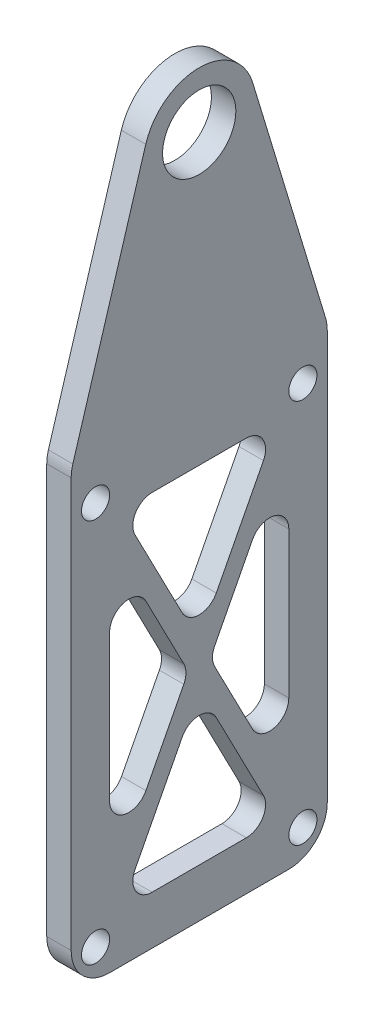
from build123d import *

# Parameters (mm, degrees)
SKETCH1_R           = 1.8288
SKETCH1_R_2         = 4.7625
BOSS_EXTRUDE1_DEPTH = 3.175
CUT_EXTRUDE1_DEPTH  = 57.415004653
FILLET1_R           = 2.5
FILLET2_R           = 5


with BuildPart() as part:
    # Sketch1 → Boss-Extrude1 (new body)
    with BuildSketch(Plane(origin=(0, 0, 0), x_dir=(0, 0, -1), z_dir=(1, 0, 0))):
        with BuildLine():
            Line((-16.645, -53.81), (16.645, -53.81))
            Line((16.645, -53.81), (16.645, 5.15))
            Line((16.645, 5.15), (6.94973031, 37.108353593))
            ThreePointArc((6.94973031, 37.108353593), (0, 42.2625), (-6.94973031, 37.108353593))
            Line((-6.94973031, 37.108353593), (-16.645, 5.15))
            Line((-16.645, 5.15), (-16.645, -53.81))
        make_face()
        with Locations((-13.4747, 0)):
            Circle(SKETCH1_R, mode=Mode.SUBTRACT)
        with Locations((0, 35)):
            Circle(SKETCH1_R_2, mode=Mode.SUBTRACT)
        with Locations((13.4747, 0)):
            Circle(SKETCH1_R, mode=Mode.SUBTRACT)
        with Locations((-13.4747, -50)):
            Circle(SKETCH1_R, mode=Mode.SUBTRACT)
        with Locations((13.4747, -50)):
            Circle(SKETCH1_R, mode=Mode.SUBTRACT)
    extrude(amount=BOSS_EXTRUDE1_DEPTH)

    # Sketch2 → Cut-Extrude1 (cut, through all)
    with BuildSketch(Plane(origin=(3.175, 0, 0), x_dir=(0, 0, -1), z_dir=(1, 0, 0))):
        Polygon((11.645, -5.219501679), (1.407493202, -25), (11.645, -44.780498321), align=None)
        Polygon((0, -27.719501679), (-10.237506798, -47.5), (10.237506798, -47.5), align=None)
        Polygon((-11.645, -5.219501679), (-11.645, -44.780498321), (-1.407493202, -25), align=None)
        Polygon((-10.237506798, -2.5), (0, -22.280498321), (10.237506798, -2.5), align=None)
    extrude(amount=-CUT_EXTRUDE1_DEPTH, mode=Mode.SUBTRACT)

    # Fillet1
    fillet1_edges = [part.edges().sort_by_distance(p)[0] for p in [
        (1.5875, -44.780498321, 11.645),
        (1.5875, -5.219501679, 11.645),
        (1.5875, -25, 1.407493202),
        (1.5875, -47.5, -10.237506798),
        (1.5875, -47.5, 10.237506798),
        (1.5875, -27.719501679, 0),
        (1.5875, -22.280498321, 0),
        (1.5875, -2.5, 10.237506798),
        (1.5875, -2.5, -10.237506798),
        (1.5875, -25, -1.407493202),
        (1.5875, -5.219501679, -11.645),
        (1.5875, -44.780498321, -11.645),
    ]]
    fillet(fillet1_edges, radius=FILLET1_R)

    # Fillet2
    fillet2_edges = [part.edges().sort_by_distance(p)[0] for p in [
        (1.5875, -53.81, -16.645),
        (1.5875, -53.81, 16.645),
        (1.5875, 5.15, 16.645),
        (1.5875, 5.15, -16.645),
    ]]
    fillet(fillet2_edges, radius=FILLET2_R)


solid = part.part
